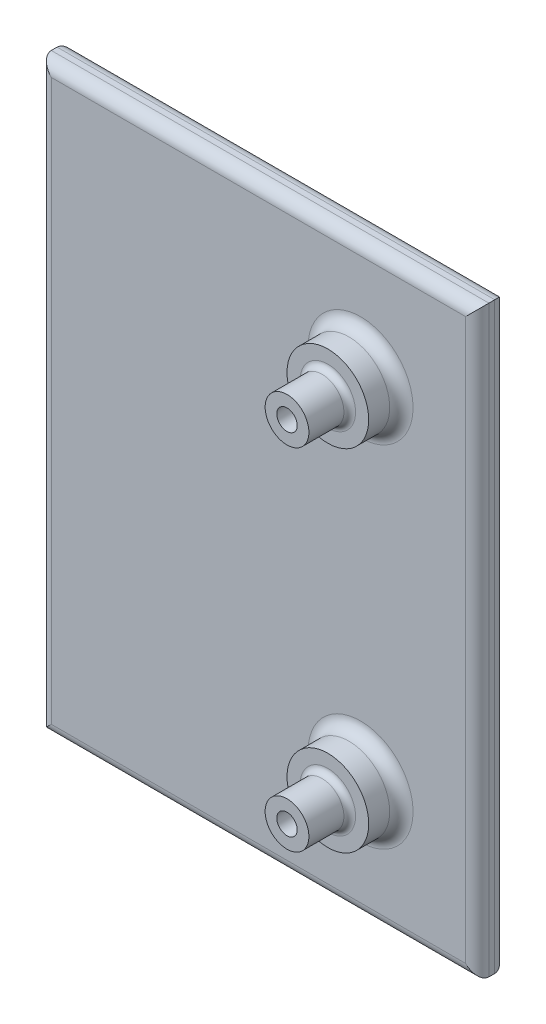
from build123d import *

# Parameters (mm, degrees)
SKETCH1_W               = 100
SKETCH1_H               = 75
PLATE_DEPTH             = 5
SKETCH2_R               = 7
BEARING_SUPPORT_DEPTH   = 5.6
SKETCH3_R               = 3.75
BEARING_PIN_DEPTH       = 7
SKETCH4_R               = 1.75
SCREW_THROUGHHOLE_DEPTH = 17.6
FILLET1_R               = 2
FILLET2_R               = 1


with BuildPart() as part:
    # Sketch1 → Plate (new body)
    with BuildSketch(Plane(origin=(0, 0, 0), x_dir=(0, 1, 0), z_dir=(0, 0, 1))):
        with Locations((50, 37.5)):
            Rectangle(SKETCH1_W, SKETCH1_H)
    extrude(amount=PLATE_DEPTH)

    # Sketch2 → Bearing Support (add)
    with BuildSketch(Plane.XY.offset(5)):
        with Locations(Location((-20, 20, 0), (0, 0, 180))):
            Circle(SKETCH2_R)
    bearing_support = extrude(amount=BEARING_SUPPORT_DEPTH)

    # Sketch3 → Bearing Pin (add)
    with BuildSketch(Plane.XY.offset(10.6)):
        with Locations((-20, 20)):
            Circle(SKETCH3_R)
    bearing_pin = extrude(amount=BEARING_PIN_DEPTH)

    # Sketch4 → Screw ThroughHole (cut)
    with BuildSketch(Plane.XY.offset(17.6)):
        with Locations((-20, 20)):
            Circle(SKETCH4_R)
    screw_throughhole = extrude(amount=-SCREW_THROUGHHOLE_DEPTH, mode=Mode.SUBTRACT)

    # Mirror1: Bearing Support, Bearing Pin, Screw ThroughHole across plane
    add(bearing_support.mirror(Plane(origin=(0, 50, 0), x_dir=(0, 0, 1), z_dir=(0, -1, 0))))
    add(bearing_pin.mirror(Plane(origin=(0, 50, 0), x_dir=(0, 0, 1), z_dir=(0, -1, 0))))
    add(screw_throughhole.mirror(Plane(origin=(0, 50, 0), x_dir=(0, 0, 1), z_dir=(0, -1, 0))), mode=Mode.SUBTRACT)

    # Fillet1
    fillet1_edges = [part.edges().sort_by_distance(p)[0] for p in [
        (-37.5, 100, 5),
        (-13, 20, 5),
        (-75, 50, 5),
        (-13, 80, 5),
        (-37.5, 0, 5),
        (-75, 50, 0),
        (-37.5, 100, 0),
        (0, 50, 0),
        (-37.5, 0, 0),
        (0, 50, 5),
    ]]
    fillet(fillet1_edges, radius=FILLET1_R)

    # Fillet2
    fillet2_edges = [part.edges().sort_by_distance(p)[0] for p in [
        (-23.75, 20, 10.6),
        (-23.75, 80, 10.6),
    ]]
    fillet(fillet2_edges, radius=FILLET2_R)


solid = part.part
